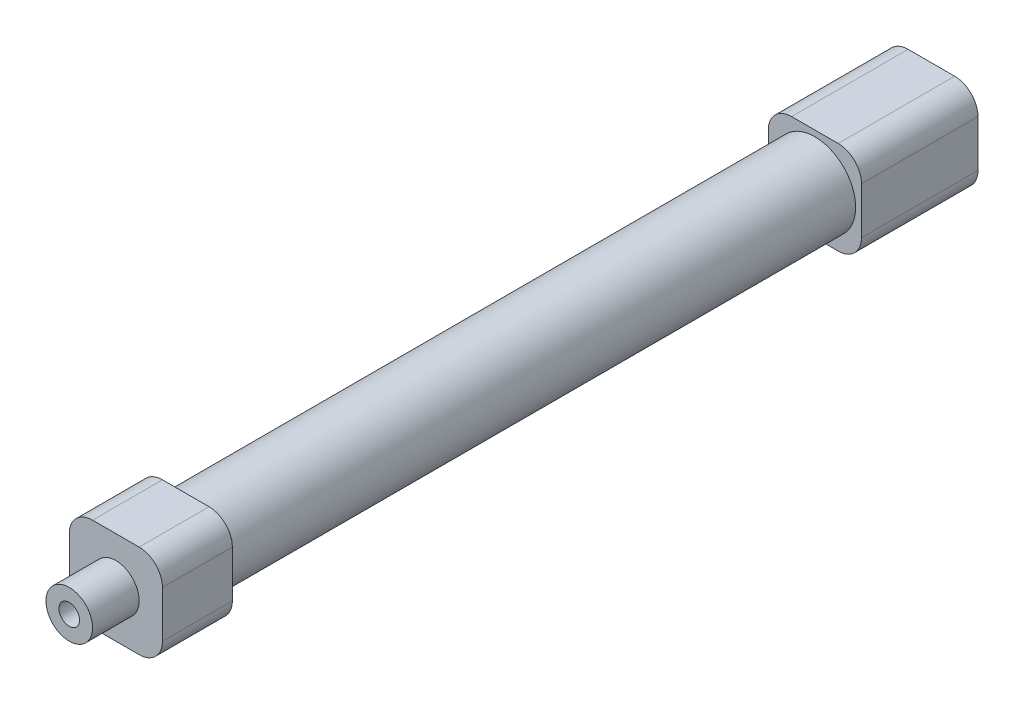
from build123d import *

# Parameters (mm, degrees)
SKETCH_1_R      = 8.75
SKETCH_1_R_2    = 8
EXTRUDE_1_DEPTH = 175
SKETCH_2_W      = 20
SKETCH_2_H      = 20
EXTRUDE_2_DEPTH = 25
SKETCH_3_W      = 20
SKETCH_3_H      = 20
SKETCH_3_R      = 4
EXTRUDE_3_DEPTH = 15
FILLET_1_R      = 5
SKETCH_5_R      = 5
SKETCH_5_R_2    = 2.212387265
EXTRUDE_4_DEPTH = 10


with BuildPart() as part:
    # 草图1 → 凸台-拉伸1 (new body)
    with BuildSketch(Plane.XY):
        Circle(SKETCH_1_R)
        Circle(SKETCH_1_R_2, mode=Mode.SUBTRACT)
    extrude(amount=EXTRUDE_1_DEPTH)

    # 草图2 → 凸台-拉伸2 (add)
    with BuildSketch(Plane.XY):
        Rectangle(SKETCH_2_W, SKETCH_2_H)
    extrude(amount=EXTRUDE_2_DEPTH)

    # 草图3 → 凸台-拉伸3 (add)
    with BuildSketch(Plane.XY.offset(175)):
        Rectangle(SKETCH_3_W, SKETCH_3_H)
        Circle(SKETCH_3_R, mode=Mode.SUBTRACT)
    extrude(amount=-EXTRUDE_3_DEPTH)

    # 圆角1
    fillet_1_edges = [part.edges().sort_by_distance(p)[0] for p in [
        (10, -10, 12.5),
        (10, 10, 12.5),
        (-10, 10, 12.5),
        (-10, -10, 12.5),
        (10, -10, 167.5),
        (-10, -10, 167.5),
        (-10, 10, 167.5),
        (10, 10, 167.5),
    ]]
    fillet(fillet_1_edges, radius=FILLET_1_R)

    # 草图5 → 凸台-拉伸4 (add)
    with BuildSketch(Plane.XY.offset(175)):
        Circle(SKETCH_5_R)
        Circle(SKETCH_5_R_2, mode=Mode.SUBTRACT)
    extrude(amount=EXTRUDE_4_DEPTH)


solid = part.part
